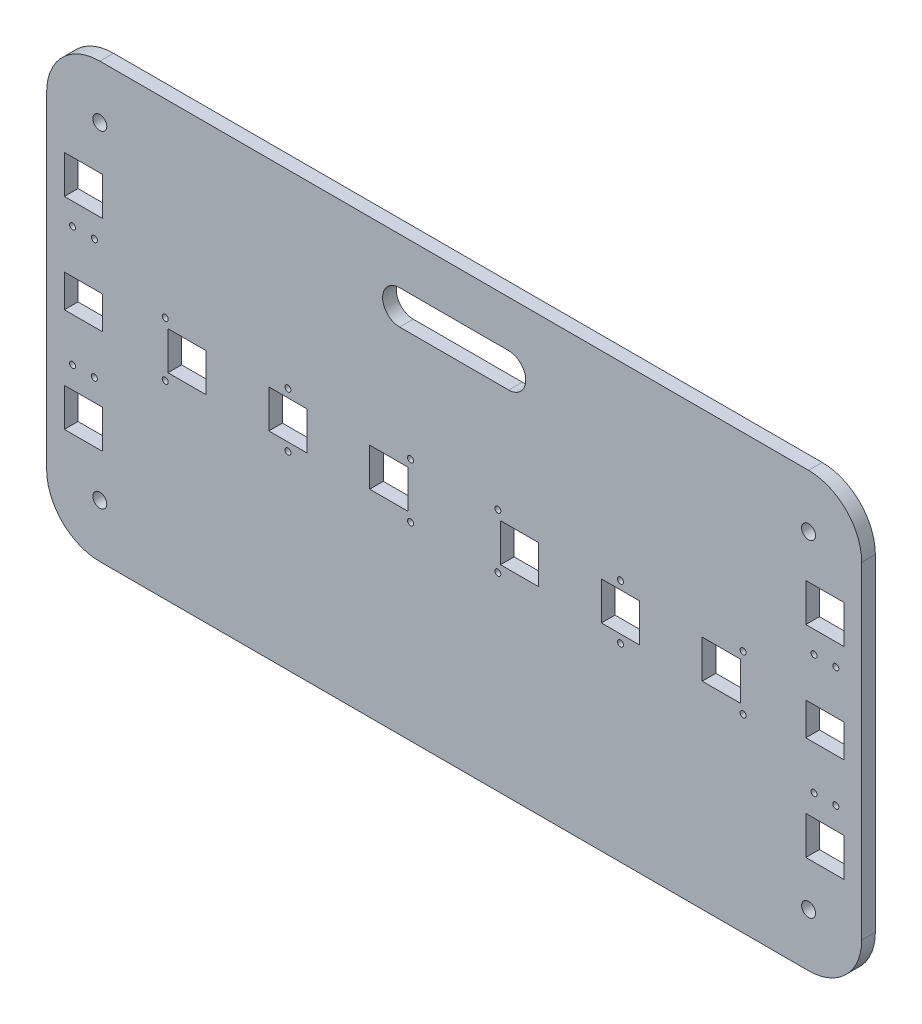
from build123d import *

# Parameters (mm, degrees)
SKETCH_2_R      = 2.55
SKETCH_2_R_2    = 1.1
SKETCH_2_W      = 14
SKETCH_2_H      = 14
SKETCH_2_H_2    = 12
EXTRUDE_1_DEPTH = 5


with BuildPart() as part:
    # 草图2 → 凸台-拉伸1 (new body)
    with BuildSketch(Plane.XY):
        with BuildLine():
            Line((-130, 29.5), (130, 29.5))
            ThreePointArc((130, 29.5), (143.788582233, 23.788582233), (149.5, 10))
            Line((149.5, 10), (149.5, -110))
            ThreePointArc((149.5, -110), (143.788582233, -123.788582233), (130, -129.5))
            Line((130, -129.5), (-130, -129.5))
            ThreePointArc((-130, -129.5), (-143.788582233, -123.788582233), (-149.5, -110))
            Line((-149.5, -110), (-149.5, 10))
            ThreePointArc((-149.5, 10), (-143.788582233, 23.788582233), (-130, 29.5))
        make_face()
        with Locations((130, -110)):
            Circle(SKETCH_2_R, mode=Mode.SUBTRACT)
        with Locations((130, 10)):
            Circle(SKETCH_2_R, mode=Mode.SUBTRACT)
        with Locations((-130, -110)):
            Circle(SKETCH_2_R, mode=Mode.SUBTRACT)
        with Locations((-130, 10)):
            Circle(SKETCH_2_R, mode=Mode.SUBTRACT)
        with Locations((-106, -40)):
            Circle(SKETCH_2_R_2, mode=Mode.SUBTRACT)
        with Locations((-106, -60)):
            Circle(SKETCH_2_R_2, mode=Mode.SUBTRACT)
        with Locations((-16, -40)):
            Circle(SKETCH_2_R_2, mode=Mode.SUBTRACT)
        with Locations((-16, -60)):
            Circle(SKETCH_2_R_2, mode=Mode.SUBTRACT)
        with Locations((-61, -60)):
            Circle(SKETCH_2_R_2, mode=Mode.SUBTRACT)
        with Locations((-61, -40)):
            Circle(SKETCH_2_R_2, mode=Mode.SUBTRACT)
        with Locations(Location((16, -60, 0), (0, 0, 180))):
            Circle(SKETCH_2_R_2, mode=Mode.SUBTRACT)
        with Locations(Location((16, -40, 0), (0, 0, 180))):
            Circle(SKETCH_2_R_2, mode=Mode.SUBTRACT)
        with Locations(Location((61, -60, 0), (0, 0, 180))):
            Circle(SKETCH_2_R_2, mode=Mode.SUBTRACT)
        with Locations(Location((61, -40, 0), (0, 0, 180))):
            Circle(SKETCH_2_R_2, mode=Mode.SUBTRACT)
        with Locations(Location((106, -60, 0), (0, 0, 180))):
            Circle(SKETCH_2_R_2, mode=Mode.SUBTRACT)
        with Locations(Location((106, -40, 0), (0, 0, 180))):
            Circle(SKETCH_2_R_2, mode=Mode.SUBTRACT)
        with Locations((140, -28)):
            Circle(SKETCH_2_R_2, mode=Mode.SUBTRACT)
        with Locations((132, -28)):
            Circle(SKETCH_2_R_2, mode=Mode.SUBTRACT)
        with Locations((132, -72)):
            Circle(SKETCH_2_R_2, mode=Mode.SUBTRACT)
        with Locations((140, -72)):
            Circle(SKETCH_2_R_2, mode=Mode.SUBTRACT)
        with Locations(Location((-140, -72, 0), (0, 0, 180))):
            Circle(SKETCH_2_R_2, mode=Mode.SUBTRACT)
        with Locations(Location((-132, -72, 0), (0, 0, 180))):
            Circle(SKETCH_2_R_2, mode=Mode.SUBTRACT)
        with Locations(Location((-132, -28, 0), (0, 0, 180))):
            Circle(SKETCH_2_R_2, mode=Mode.SUBTRACT)
        with Locations(Location((-140, -28, 0), (0, 0, 180))):
            Circle(SKETCH_2_R_2, mode=Mode.SUBTRACT)
        with Locations((-61, -50)):
            Rectangle(SKETCH_2_W, SKETCH_2_H, mode=Mode.SUBTRACT)
        with Locations((-24, -50)):
            Rectangle(SKETCH_2_W, SKETCH_2_H, mode=Mode.SUBTRACT)
        with Locations((24, -50)):
            Rectangle(SKETCH_2_W, SKETCH_2_H, mode=Mode.SUBTRACT)
        with Locations((136, -87)):
            Rectangle(SKETCH_2_W, SKETCH_2_H, mode=Mode.SUBTRACT)
        with Locations((136, -13)):
            Rectangle(SKETCH_2_W, SKETCH_2_H, mode=Mode.SUBTRACT)
        with BuildLine():
            Line((-20, 12.5), (20, 12.5))
            ThreePointArc((20, 12.5), (26.25, 6.25), (20, 0))
            Line((20, 0), (-20, 0))
            ThreePointArc((-20, 0), (-26.25, 6.25), (-20, 12.5))
        make_face(mode=Mode.SUBTRACT)
        with Locations((-136, -87)):
            Rectangle(SKETCH_2_W, SKETCH_2_H, mode=Mode.SUBTRACT)
        with Locations((-136, -13)):
            Rectangle(SKETCH_2_W, SKETCH_2_H, mode=Mode.SUBTRACT)
        with Locations((-98, -50)):
            Rectangle(SKETCH_2_W, SKETCH_2_H, mode=Mode.SUBTRACT)
        with Locations((61, -50)):
            Rectangle(SKETCH_2_W, SKETCH_2_H, mode=Mode.SUBTRACT)
        with Locations((98, -50)):
            Rectangle(SKETCH_2_W, SKETCH_2_H, mode=Mode.SUBTRACT)
        with Locations((-136, -50)):
            Rectangle(SKETCH_2_W, SKETCH_2_H_2, mode=Mode.SUBTRACT)
        with Locations((136, -50)):
            Rectangle(SKETCH_2_W, SKETCH_2_H_2, mode=Mode.SUBTRACT)
    extrude(amount=EXTRUDE_1_DEPTH)


solid = part.part
